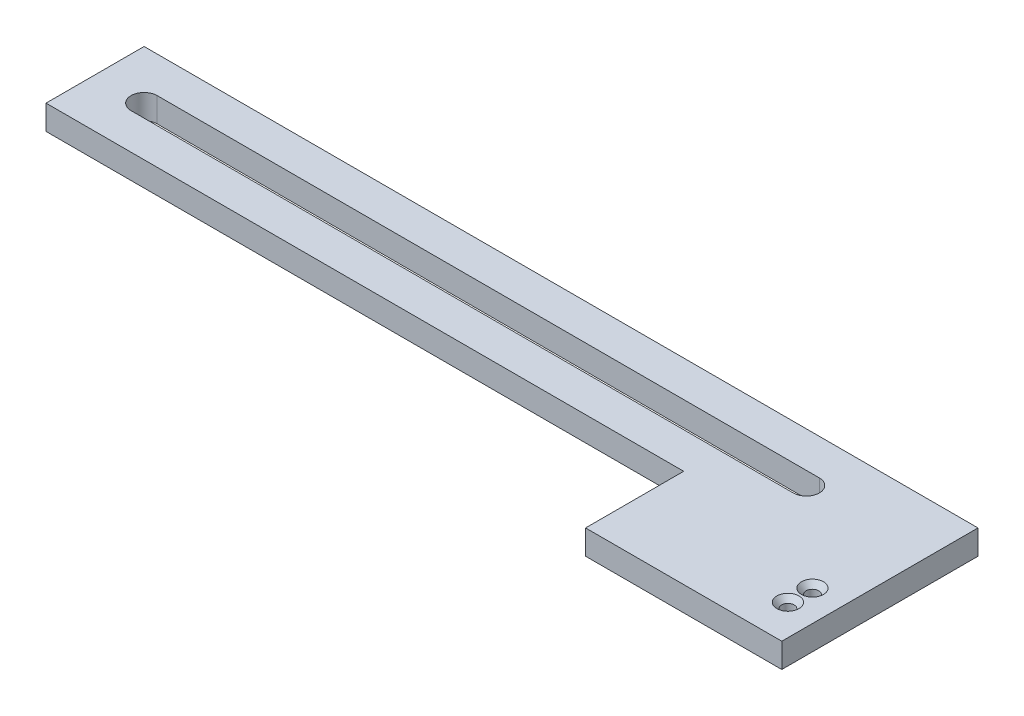
from build123d import *

# Parameters (mm, degrees)
BOSS_EXTRUDE1_DEPTH                            = 6.35
CUT_EXTRUDE1_DEPTH                             = 222.886846163
CSK_FOR_4_FLAT_HEAD_MACHINE_SCREW1_D           = 3.2639
CSK_FOR_4_FLAT_HEAD_MACHINE_SCREW1_CSINK_D     = 5.715
CSK_FOR_4_FLAT_HEAD_MACHINE_SCREW1_CSINK_ANGLE = 82


with BuildPart() as part:
    # Sketch1 → Boss-Extrude1 (new body)
    with BuildSketch(Plane(origin=(0, 0, 0), x_dir=(1, 0, 0), z_dir=(0, 1, 0))):
        Polygon((0, 0), (215.9, 0), (215.9, -50.8), (165.1, -50.8), (165.1, -25.4), (0, -25.4), align=None)
    extrude(amount=BOSS_EXTRUDE1_DEPTH)

    # Sketch2 → Cut-Extrude1 (cut, through all)
    with BuildSketch(Plane(origin=(0, 6.35, 0), x_dir=(1, 0, 0), z_dir=(0, 1, 0))):
        with BuildLine():
            Line((184.15, -16.0782), (12.7, -16.0782))
            ThreePointArc((12.7, -16.0782), (9.3218, -12.7), (12.7, -9.3218))
            Line((12.7, -9.3218), (184.15, -9.3218))
            ThreePointArc((184.15, -9.3218), (187.5282, -12.7), (184.15, -16.0782))
        make_face()
    extrude(amount=-CUT_EXTRUDE1_DEPTH, mode=Mode.SUBTRACT)

    # CSK for #4 Flat Head Machine Screw1 (through all)
    with Locations(Plane(origin=(0, 6.35, 0), x_dir=(1, 0, 0), z_dir=(0, 1, 0))):
        with Locations((207.9625, -34.925), (207.9625, -41.275)):
            CounterSinkHole(CSK_FOR_4_FLAT_HEAD_MACHINE_SCREW1_D / 2, CSK_FOR_4_FLAT_HEAD_MACHINE_SCREW1_CSINK_D / 2, counter_sink_angle=CSK_FOR_4_FLAT_HEAD_MACHINE_SCREW1_CSINK_ANGLE)


solid = part.part
